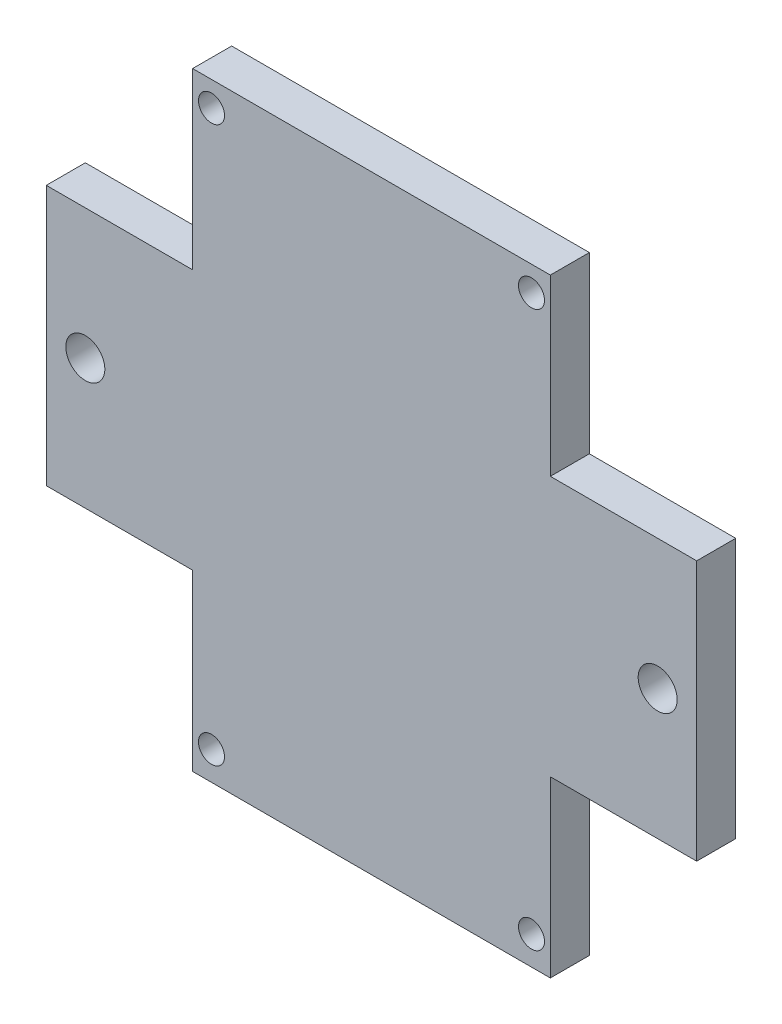
from build123d import *

# Parameters (mm, degrees)
SKETCH_2_W           = 27.5
SKETCH_2_H           = 3
EXTRUDE_1_DEPTH      = 46.8
SKETCH_3_R           = 1
CUT_EXTRUDE_1_DEPTH  = 46.8
EXTRUDE_2_DEPTH      = 25
EXTRUDE_2_DEPTH_BACK = 25
SKETCH_4_W           = 3
SKETCH_4_H           = 20
SKETCH_5_R           = 1.5
CUT_EXTRUDE_2_DEPTH  = 25


with BuildPart() as part:
    # 草图2 → 凸台-拉伸1 (new body)
    with BuildSketch(Plane(origin=(0, 0, 0), x_dir=(1, 0, 0), z_dir=(0, 1, 0))):
        Rectangle(SKETCH_2_W, SKETCH_2_H)
    extrude(amount=EXTRUDE_1_DEPTH)

    # 草图3 → 切除-拉伸1 (cut)
    with BuildSketch(Plane(origin=(0, 0, -1.5), x_dir=(-1, 0, 0), z_dir=(0, 0, -1))):
        with Locations((-12.3, 44.893116562)):
            Circle(SKETCH_3_R)
        with Locations((-12.3, 2.2)):
            Circle(SKETCH_3_R)
        with Locations((12.3, 2.2)):
            Circle(SKETCH_3_R)
        with Locations((12.3, 44.893116562)):
            Circle(SKETCH_3_R)
    extrude(amount=-CUT_EXTRUDE_1_DEPTH, mode=Mode.SUBTRACT)

    # 草图4 → 凸台-拉伸2 (add, two sides: drawn at the far end of the back side and taken through both)
    with BuildSketch(Plane(origin=(0, 0, 0), x_dir=(0, 0, -1), z_dir=(1, 0, 0)).offset(-EXTRUDE_2_DEPTH_BACK)):
        with Locations((0, 23.4)):
            Rectangle(SKETCH_4_W, SKETCH_4_H)
    extrude(amount=EXTRUDE_2_DEPTH + EXTRUDE_2_DEPTH_BACK)

    # 草图5 → 切除-拉伸2 (cut)
    with BuildSketch(Plane(origin=(0, 0, -1.5), x_dir=(-1, 0, 0), z_dir=(0, 0, -1))):
        with Locations((-22, 23.4)):
            Circle(SKETCH_5_R)
        with Locations((22, 23.4)):
            Circle(SKETCH_5_R)
    extrude(amount=-CUT_EXTRUDE_2_DEPTH, mode=Mode.SUBTRACT)


solid = part.part
